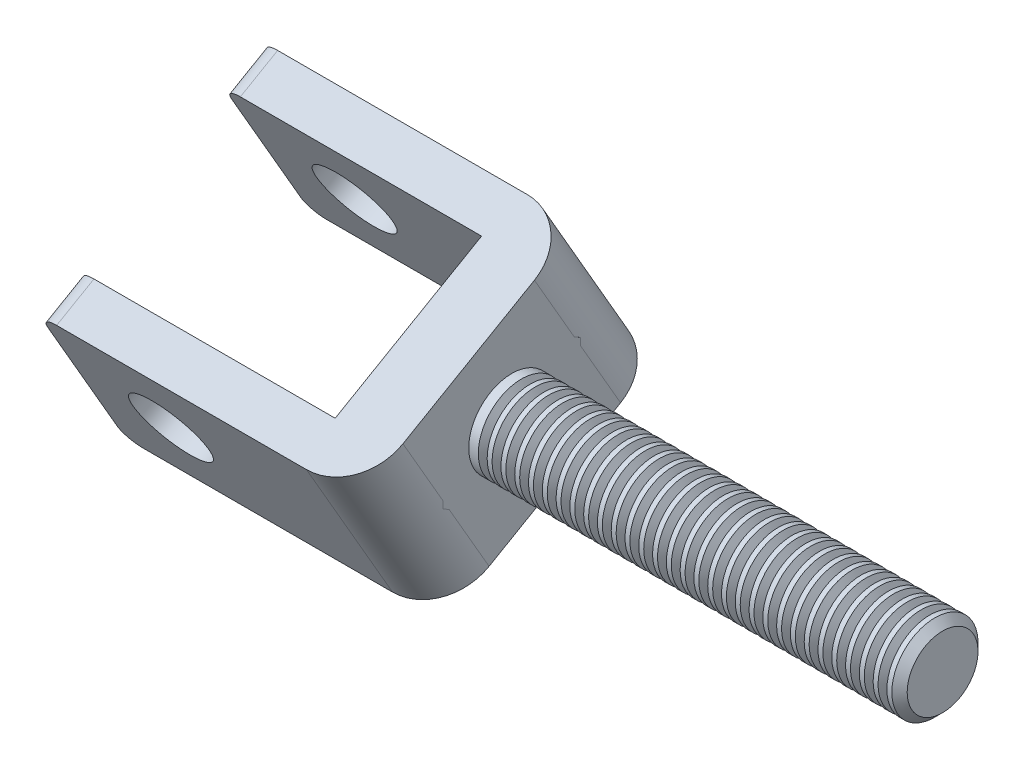
from build123d import *

# Parameters (mm, degrees)
BASEHEAD_DEPTH      = 3.5
THDSCHPAT_COUNT     = 30
THDSCHPAT_PITCH     = 0.8
BOSS_EXTRUDE1_DEPTH = 5
FILLET1_R           = 1
SKETCH2_R           = 2.210363486
CUT_EXTRUDE1_DEPTH  = 23


with BuildPart() as part:
    # BaseHeadSke → BaseHead (new body)
    with BuildSketch(Plane(origin=(0, 0, 0), x_dir=(0, 0, -1), z_dir=(1, 0, 0))):
        Polygon((0, 4.618802154), (-4, 2.309401077), (-4, -2.309401077), (0, -4.618802154), (4, -2.309401077), (4, 2.309401077), align=None)
    extrude(amount=BASEHEAD_DEPTH)

    # HeadChamferSke → HeadChamfer (revolve, cut)
    with BuildSketch(Plane.XY):
        Polygon((0, 4.618802154), (0, 4), (0.35726559, 4.618802154), align=None)
    revolve(axis=Axis((0, 0, 0), (1, 0, 0)), mode=Mode.SUBTRACT)

    # BodySke → BaseBody (revolve)
    with BuildSketch(Plane.XY, mode=Mode.PRIVATE) as basebody_sk:
        Polygon((0, 0), (0, 2.5), (28.055, 2.5), (28.5, 2.055), (28.5, 0), align=None)
    revolve(basebody_sk.sketch.rotate(Axis((0, 0, 0), (1, 0, 0)), 90), axis=Axis((0, 0, 0), (1, 0, 0)))

    # ThdSchSke → ThreadSchematic (revolve, cut)
    with BuildSketch(Plane.XY, mode=Mode.PRIVATE) as threadschematic_sk:
        Polygon((27.255, 3.01384174), (27.255, 2.5), (27.51192087, 2.055), (27.76884174, 2.5), (27.76884174, 3.01384174), align=None)
    threadschematic = revolve(threadschematic_sk.sketch.rotate(Axis((0, 0, 0), (1, 0, 0)), 90), axis=Axis((0, 0, 0), (1, 0, 0)), mode=Mode.SUBTRACT)

    # ThdSchPat: ThreadSchematic ×30
    with Locations(*[(-i * THDSCHPAT_PITCH, 0, 0) for i in range(1, THDSCHPAT_COUNT)]):
        add(threadschematic, mode=Mode.SUBTRACT)

    # Sketch1 → Boss-Extrude1 (add, symmetric)
    with BuildSketch(Plane(origin=(0, 0, 0), x_dir=(-1, 0, 0), z_dir=(0, -0.8660254037844388, -0.49999999999999983))):
        with BuildLine():
            Line((0, 7.400996674), (15, 7.400996674))
            Line((15, 7.400996674), (15, 4.900996674))
            Line((15, 4.900996674), (0, 4.900996674))
            Line((0, 4.900996674), (0, 0))
            Line((0, 0), (0, -4.909542525))
            Line((0, -4.909542525), (15, -4.909542525))
            Line((15, -4.909542525), (15, -7.409542525))
            Line((15, -7.409542525), (-0.5, -7.409542525))
            ThreePointArc((-0.5, -7.409542525), (-2.621320344, -6.530862869), (-3.5, -4.409542525))
            Line((-3.5, -4.409542525), (-3.5, 4.400996674))
            ThreePointArc((-3.5, 4.400996674), (-2.621320344, 6.522317018), (-0.5, 7.400996674))
            Line((-0.5, 7.400996674), (0, 7.400996674))
        make_face()
    extrude(amount=BOSS_EXTRUDE1_DEPTH, both=True)

    # Fillet1
    fillet1_edges = [part.edges().sort_by_distance(p)[0] for p in [
        (-15, 1.250355756, 7.834320303),
        (-15, 7.405625356, -2.826919378),
        (-15, -7.409898282, 2.834320303),
        (-15, -1.254628682, -7.826919378),
    ]]
    fillet(fillet1_edges, radius=FILLET1_R)

    # Sketch2 → Cut-Extrude1 (cut)
    with BuildSketch(Plane(origin=(0, -3.704771263, 6.416852057), x_dir=(1, 0, 0), z_dir=(0, -0.49999999999999983, 0.8660254037844387))):
        with Locations(Location((-9.867615043, 0, 0), (0, 0, 270))):
            Circle(SKETCH2_R)
    extrude(amount=-CUT_EXTRUDE1_DEPTH, mode=Mode.SUBTRACT)


solid = part.part
